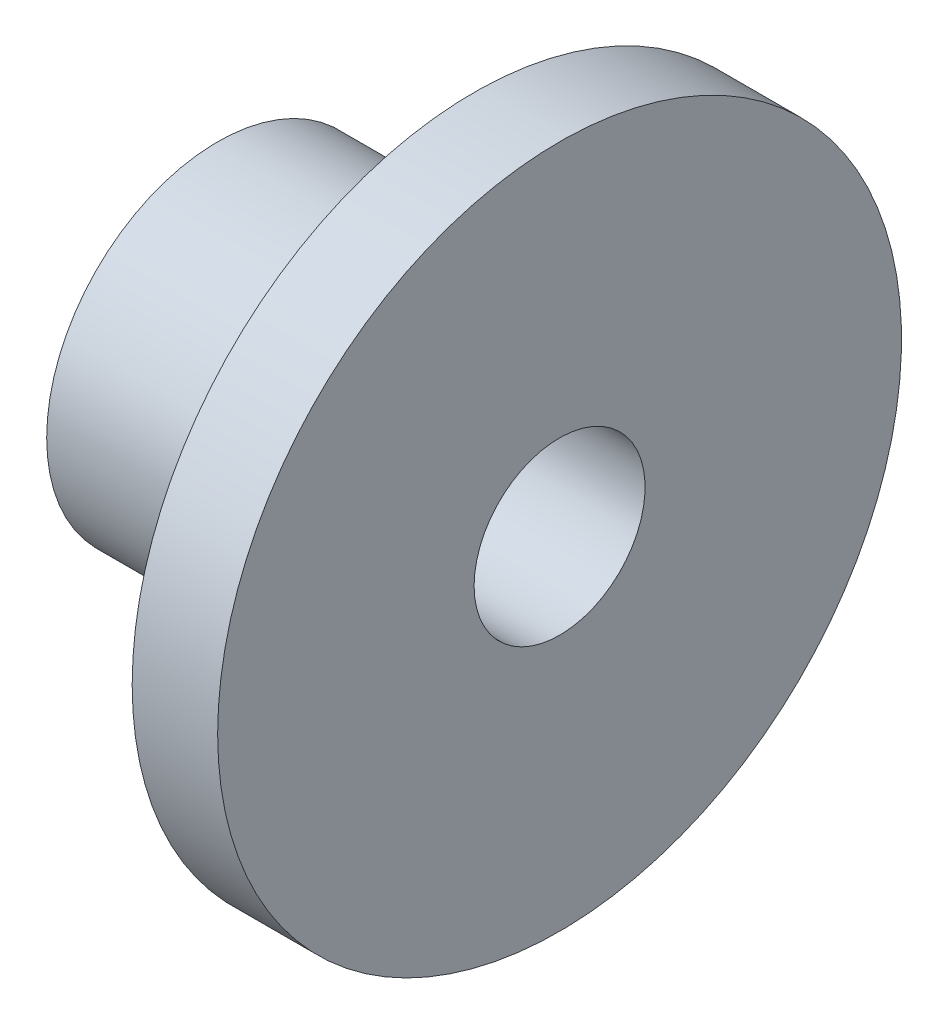
from build123d import *


with BuildPart() as part:
    # Sketch1 → Revolve1 (revolve)
    with BuildSketch(Plane(origin=(0, 0, 0), x_dir=(1, 0, 0), z_dir=(0, 1, 0)), mode=Mode.PRIVATE) as revolve1_sk:
        Polygon((0, 2), (0, 4), (6, 4), (6, 8), (8, 8), (8, 2), align=None)
    revolve(revolve1_sk.sketch.rotate(Axis((0, 0, 0), (1, 0, 0)), 180), axis=Axis((0, 0, 0), (1, 0, 0)))


solid = part.part
